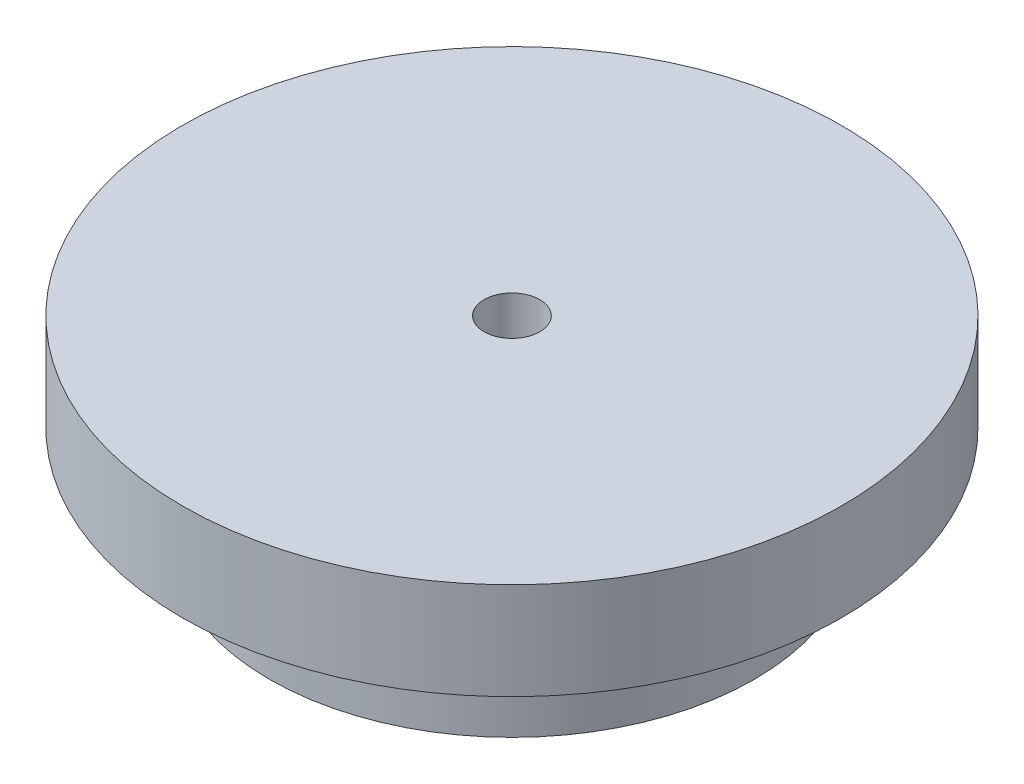
from build123d import *

# Parameters (mm, degrees)
SKETCH1_R           = 25
BOSS_EXTRUDE1_DEPTH = 10
SKETCH2_R           = 34
SKETCH2_R_2         = 2.875
BOSS_EXTRUDE2_DEPTH = 10


with BuildPart() as part:
    # Sketch1 → Boss-Extrude1 (new body)
    with BuildSketch(Plane(origin=(0, 0, 0), x_dir=(1, 0, 0), z_dir=(0, 1, 0))):
        with Locations(Location((0, 0, 0), (0, 0, 270))):
            Circle(SKETCH1_R)
        with BuildLine():
            Line((0, 4.5), (-0.922144385, 5.422144385))
            ThreePointArc((-0.922144385, 5.422144385), (-1.423504748, 5.312592045), (-1.912471729, 5.156786973))
            Line((-1.912471729, 5.156786973), (-2.25, 3.897114317))
            Line((-2.25, 3.897114317), (-3.509672656, 4.234642588))
            ThreePointArc((-3.509672656, 4.234642588), (-3.889087297, 3.889087297), (-4.234642588, 3.509672656))
            Line((-4.234642588, 3.509672656), (-3.897114317, 2.25))
            Line((-3.897114317, 2.25), (-5.156786973, 1.912471729))
            ThreePointArc((-5.156786973, 1.912471729), (-5.312592045, 1.423504748), (-5.422144385, 0.922144385))
            Line((-5.422144385, 0.922144385), (-4.5, 0))
            Line((-4.5, 0), (-5.422144385, -0.922144385))
            ThreePointArc((-5.422144385, -0.922144385), (-5.312592045, -1.423504748), (-5.156786973, -1.912471729))
            Line((-5.156786973, -1.912471729), (-3.897114317, -2.25))
            Line((-3.897114317, -2.25), (-4.234642588, -3.509672656))
            ThreePointArc((-4.234642588, -3.509672656), (-3.889087297, -3.889087297), (-3.509672656, -4.234642588))
            Line((-3.509672656, -4.234642588), (-2.25, -3.897114317))
            Line((-2.25, -3.897114317), (-1.912471729, -5.156786973))
            ThreePointArc((-1.912471729, -5.156786973), (-1.423504748, -5.312592045), (-0.922144385, -5.422144385))
            Line((-0.922144385, -5.422144385), (0, -4.5))
            Line((0, -4.5), (0.922144385, -5.422144385))
            ThreePointArc((0.922144385, -5.422144385), (1.423504748, -5.312592045), (1.912471729, -5.156786973))
            Line((1.912471729, -5.156786973), (2.25, -3.897114317))
            Line((2.25, -3.897114317), (3.509672656, -4.234642588))
            ThreePointArc((3.509672656, -4.234642588), (3.889087297, -3.889087297), (4.234642588, -3.509672656))
            Line((4.234642588, -3.509672656), (3.897114317, -2.25))
            Line((3.897114317, -2.25), (5.156786973, -1.912471729))
            ThreePointArc((5.156786973, -1.912471729), (5.312592045, -1.423504748), (5.422144385, -0.922144385))
            Line((5.422144385, -0.922144385), (4.5, 0))
            Line((4.5, 0), (5.422144385, 0.922144385))
            ThreePointArc((5.422144385, 0.922144385), (5.312592045, 1.423504748), (5.156786973, 1.912471729))
            Line((5.156786973, 1.912471729), (3.897114317, 2.25))
            Line((3.897114317, 2.25), (4.234642588, 3.509672656))
            ThreePointArc((4.234642588, 3.509672656), (3.889087297, 3.889087297), (3.509672656, 4.234642588))
            Line((3.509672656, 4.234642588), (2.25, 3.897114317))
            Line((2.25, 3.897114317), (1.912471729, 5.156786973))
            ThreePointArc((1.912471729, 5.156786973), (1.423504748, 5.312592045), (0.922144385, 5.422144385))
            Line((0.922144385, 5.422144385), (0, 4.5))
        make_face(mode=Mode.SUBTRACT)
    extrude(amount=BOSS_EXTRUDE1_DEPTH)

    # Sketch2 → Boss-Extrude2 (add)
    with BuildSketch(Plane(origin=(0, 10, 0), x_dir=(1, 0, 0), z_dir=(0, 1, 0))):
        with Locations(Location((0, 0, 0), (0, 0, 270))):
            Circle(SKETCH2_R)
        with Locations(Location((0, 0, 0), (0, 0, 270))):
            Circle(SKETCH2_R_2, mode=Mode.SUBTRACT)
    extrude(amount=BOSS_EXTRUDE2_DEPTH)


solid = part.part
